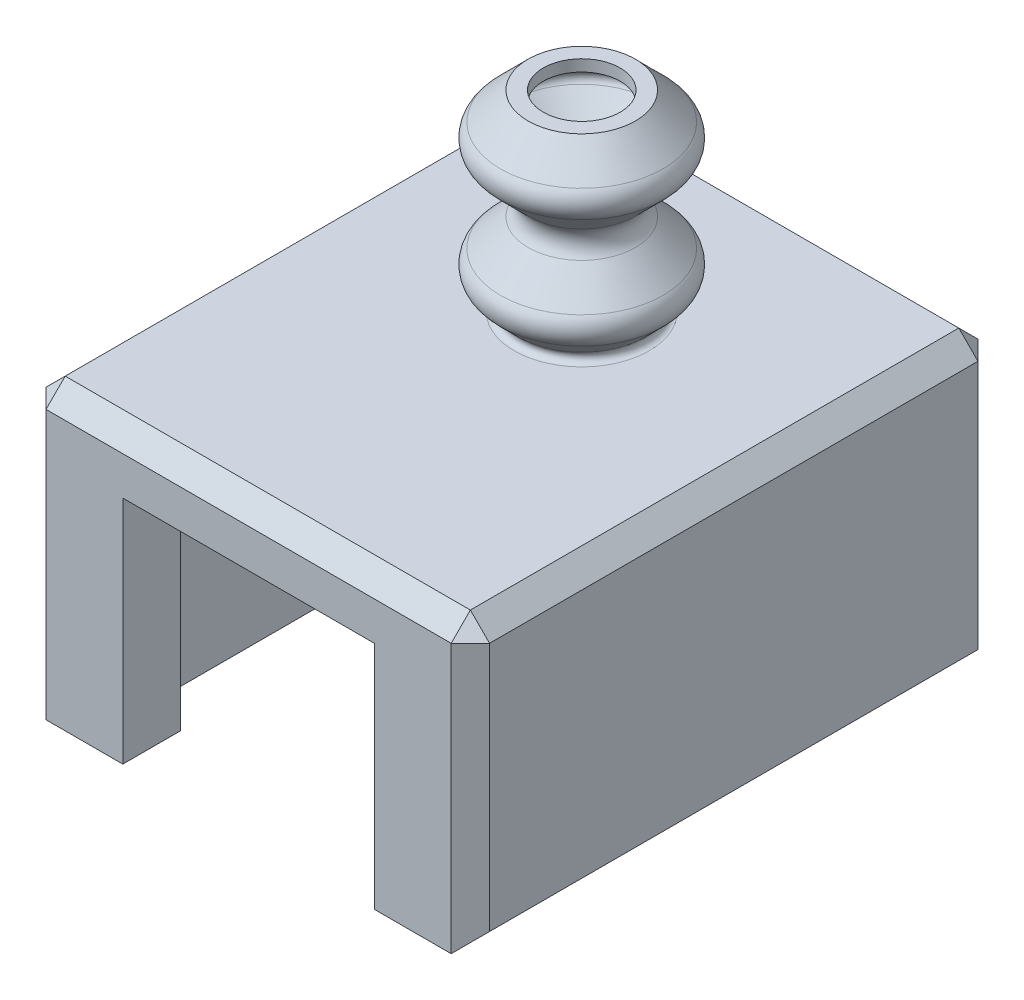
from build123d import *

# Parameters (mm, degrees)
CUT_EXTRUDE1_REACH  = 13.872
SKETCH2_R           = 2
SKETCH3_W           = 23.1
SKETCH3_H           = 27.435786438
SKETCH3_W_2         = 17.1
SKETCH3_H_2         = 17.1
BOSS_EXTRUDE1_DEPTH = 15
SKETCH4_W           = 23.1
SKETCH4_H           = 27.435786438
BOSS_EXTRUDE3_DEPTH = 1
FILLET2_R           = 0.3
CUT_EXTRUDE2_REACH  = 27.108
SKETCH5_R           = 2.792893219
SKETCH6_W           = 13.1
SKETCH6_H           = 3
CUT_EXTRUDE3_DEPTH  = 12
CHAMFER1_SIZE       = 1


with BuildPart() as part:
    # Sketch1 → Revolve1 (revolve)
    with BuildSketch(Plane.XY, mode=Mode.PRIVATE) as revolve1_sk:
        with BuildLine():
            Line((0, 0.6), (0, 0))
            Line((0, 0), (2.792893219, 0))
            Line((2.792893219, 0), (4.232233047, 1.439339828))
            ThreePointArc((4.232233047, 1.439339828), (4.525126266, 2.146446609), (4.232233047, 2.853553391))
            Line((4.232233047, 2.853553391), (2.792893219, 4.292893219))
            ThreePointArc((2.792893219, 4.292893219), (2.5, 5), (2.792893219, 5.707106781))
            Line((2.792893219, 5.707106781), (4.232233047, 7.146446609))
            ThreePointArc((4.232233047, 7.146446609), (4.525126266, 7.853553391), (4.232233047, 8.560660172))
            Line((4.232233047, 8.560660172), (2.792893219, 10))
            Line((2.792893219, 10), (0, 10))
            Line((0, 10), (0, 9.4))
            Line((0, 9.4), (2.544365081, 9.4))
            Line((2.544365081, 9.4), (3.807968978, 8.136396103))
            ThreePointArc((3.807968978, 8.136396103), (3.925126266, 7.853553391), (3.807968978, 7.570710678))
            Line((3.807968978, 7.570710678), (2.36862915, 6.13137085))
            ThreePointArc((2.36862915, 6.13137085), (1.9, 5), (2.36862915, 3.86862915))
            Line((2.36862915, 3.86862915), (3.807968978, 2.429289322))
            ThreePointArc((3.807968978, 2.429289322), (3.925126266, 2.146446609), (3.807968978, 1.863603897))
            Line((3.807968978, 1.863603897), (2.544365081, 0.6))
            Line((2.544365081, 0.6), (0, 0.6))
        make_face()
    revolve(revolve1_sk.sketch.rotate(Axis((0, 10, 0), (0, -1, 0)), 90), axis=Axis((0, 10, 0), (0, -1, 0)))

    # Sketch2 → Cut-Extrude1 (cut, up to next)
    with BuildSketch(Plane(origin=(0, 10, 0), x_dir=(1, 0, 0), z_dir=(0, 1, 0)), mode=Mode.PRIVATE) as cut_extrude1_sk1:
        with Locations(Location((0, 0, 0), (0, 0, 270))):
            Circle(SKETCH2_R)
    cut_extrude1_tool1 = extrude(cut_extrude1_sk1.sketch, amount=-CUT_EXTRUDE1_REACH, mode=Mode.PRIVATE) & part.part
    add(cut_extrude1_tool1.solids().sort_by_distance((0, 10, 0))[0], mode=Mode.SUBTRACT)

    # Sketch3 → Boss-Extrude1 (add)
    with BuildSketch(Plane.XZ):
        with Locations((0, 3.632106781)):
            Rectangle(SKETCH3_W, SKETCH3_H)
        with Locations((0, 5.8)):
            Rectangle(SKETCH3_W_2, SKETCH3_H_2, mode=Mode.SUBTRACT)
    extrude(amount=BOSS_EXTRUDE1_DEPTH)

    # Sketch4 → Boss-Extrude3 (add)
    with BuildSketch(Plane(origin=(0, 0, 0), x_dir=(1, 0, 0), z_dir=(0, 1, 0))):
        with Locations((0, -3.632106781)):
            Rectangle(SKETCH4_W, SKETCH4_H)
    extrude(amount=-BOSS_EXTRUDE3_DEPTH)

    # Fillet2
    fillet2_edges = [part.edges().sort_by_distance(p)[0] for p in [
        (0, 0, -2.792893219),
    ]]
    fillet(fillet2_edges, radius=FILLET2_R)

    # Sketch5 → Cut-Extrude2 (cut, up to next)
    with BuildSketch(Plane(origin=(0, -1, 0), x_dir=(1, 0, 0), z_dir=(0, 1, 0)), mode=Mode.PRIVATE) as cut_extrude2_sk1:
        with Locations(Location((0, 0, 0), (0, 0, 79.945460625))):
            Circle(SKETCH5_R)
    cut_extrude2_tool1 = extrude(cut_extrude2_sk1.sketch, amount=CUT_EXTRUDE2_REACH, mode=Mode.PRIVATE) & part.part
    add(cut_extrude2_tool1.solids().sort_by_distance((0, -1, 0))[0], mode=Mode.SUBTRACT)

    # Sketch6 → Cut-Extrude3 (cut)
    with BuildSketch(Plane.XZ.offset(15)):
        with Locations((0, 15.85)):
            Rectangle(SKETCH6_W, SKETCH6_H)
    extrude(amount=-CUT_EXTRUDE3_DEPTH, mode=Mode.SUBTRACT)

    # Chamfer1
    chamfer1_edges = [part.edges().sort_by_distance(p)[0] for p in [
        (-11.55, 0, 3.632106781),
        (-11.55, -7.5, 17.35),
        (0, 0, -10.085786438),
        (-11.55, -7.5, -10.085786438),
        (11.55, -15, 3.632106781),
        (11.55, -7.5, -10.085786438),
        (11.55, -7.5, 17.35),
        (-11.55, -15, 3.632106781),
        (0, -15, -10.085786438),
        (0, 0, 17.35),
        (11.55, 0, 3.632106781),
    ]]
    chamfer(chamfer1_edges, length=CHAMFER1_SIZE)


solid = part.part
